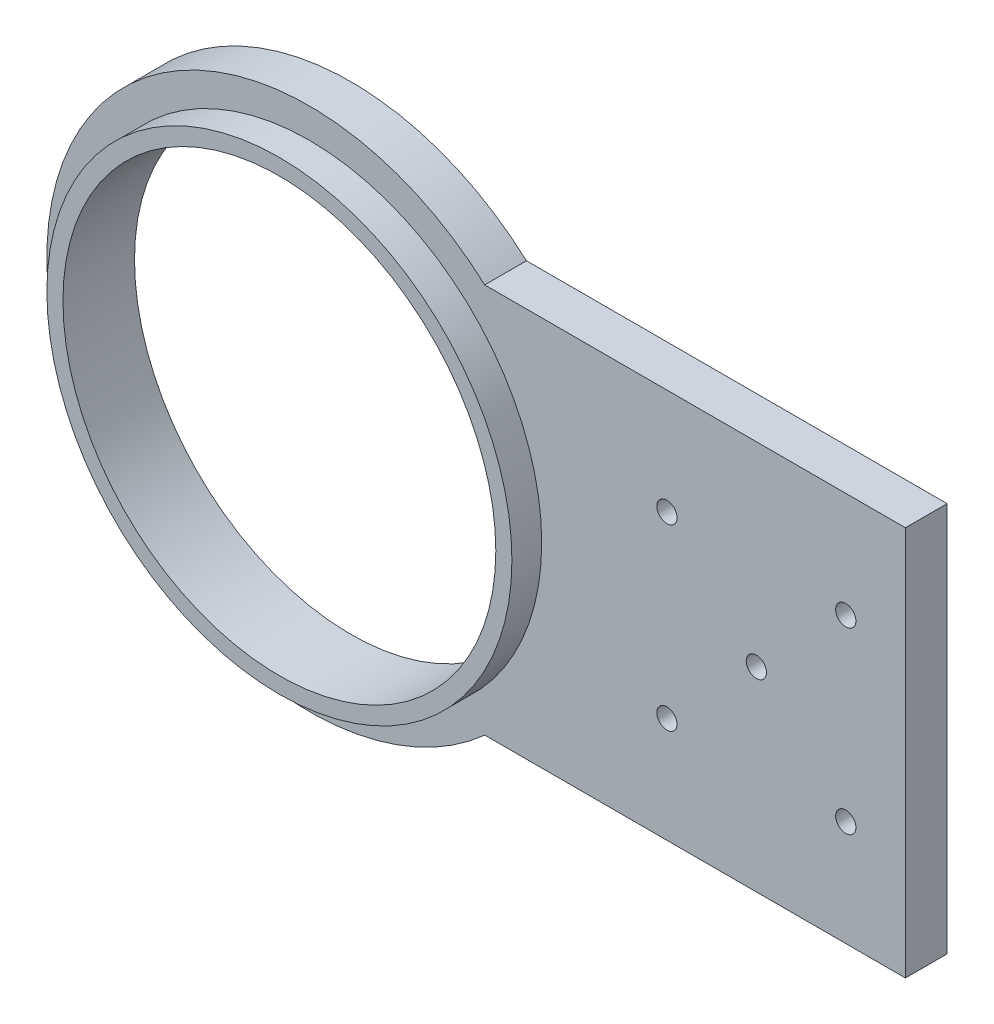
from build123d import *
from build123d.topology import SkipClean

# Parameters (mm, degrees)
CROQUIS1_R                                           = 39
CROQUIS1_R_2                                         = 36.3
SALIENTE_EXTRUIR1_DEPTH                              = 2.5
SALIENTE_EXTRUIR2_START                              = 7
CROQUIS2_R                                           = 44
CROQUIS2_R_2                                         = 36.3
SALIENTE_EXTRUIR2_DEPTH                              = 7
SALIENTE_EXTRUIR3_DEPTH                              = 7
REFRENTADO_PARA_TORNILLO_CON_CABEZA_TRON_D           = 3.4
REFRENTADO_PARA_TORNILLO_CON_CABEZA_TRON_CBORE_D     = 7
REFRENTADO_PARA_TORNILLO_CON_CABEZA_TRON_CBORE_DEPTH = 2.4


with BuildPart() as part:
    # Croquis1 → Saliente-Extruir1 (new, symmetric)
    with BuildSketch(Plane.XY):
        Circle(CROQUIS1_R)
        Circle(CROQUIS1_R_2, mode=Mode.SUBTRACT)
    extrude(amount=SALIENTE_EXTRUIR1_DEPTH, both=True)

    # Croquis2 → Saliente-Extruir2 (add)
    with SkipClean():  # the faces are left unmerged after this step: merging them gives an invalid solid
        with BuildSketch(Plane(origin=(0, 0, -2.5), x_dir=(-1, 0, 0), z_dir=(0, 0, -1)).offset(SALIENTE_EXTRUIR2_START)):
            Circle(CROQUIS2_R)
            Circle(CROQUIS2_R_2, mode=Mode.SUBTRACT)
        extrude(amount=-SALIENTE_EXTRUIR2_DEPTH)

    # Croquis3 → Saliente-Extruir3 (add)
    with SkipClean():  # the faces are left unmerged after this step: merging them gives an invalid solid
        with BuildSketch(Plane(origin=(0, 0, -9.5), x_dir=(-1, 0, 0), z_dir=(0, 0, -1))):
            with BuildLine():
                ThreePointArc((-29.439938859, -32.7), (-44, 0), (-29.439938859, 32.7))
                Line((-29.439938859, 32.7), (-100, 32.7))
                Line((-100, 32.7), (-100, -32.7))
                Line((-100, -32.7), (-29.439938859, -32.7))
            make_face()
        extrude(amount=-SALIENTE_EXTRUIR3_DEPTH)

    # Refrentado para tornillo con cabeza troncocónica de M31 (through all)
    with Locations(Plane(origin=(0, 0, -9.5), x_dir=(-1, 0, 0), z_dir=(0, 0, -1))):
        with Locations((-75, 0), (-90, 15), (-60, -15), (-60, 15), (-90, -15)):
            CounterBoreHole(REFRENTADO_PARA_TORNILLO_CON_CABEZA_TRON_D / 2, REFRENTADO_PARA_TORNILLO_CON_CABEZA_TRON_CBORE_D / 2, REFRENTADO_PARA_TORNILLO_CON_CABEZA_TRON_CBORE_DEPTH)


solid = part.part
